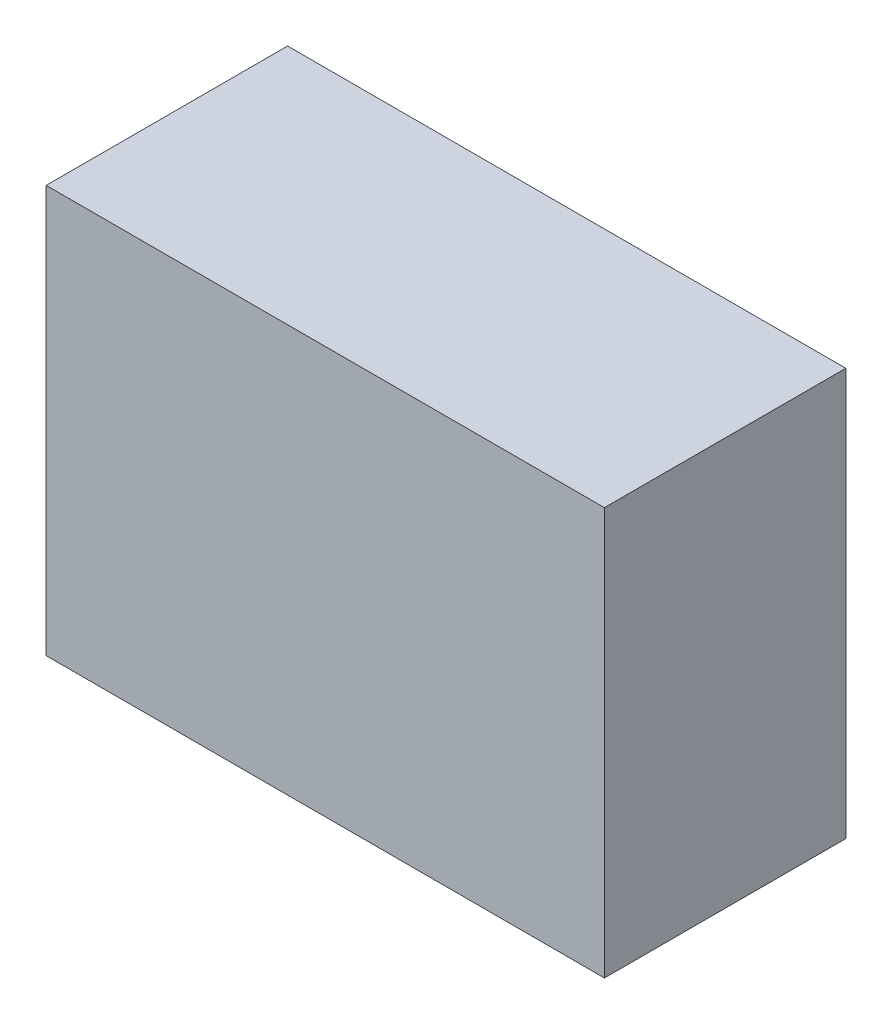
from build123d import *

# Parameters (mm, degrees)
SKETCH1_W     = 37
SKETCH1_H     = 27
PROFILE_DEPTH = 16


with BuildPart() as part:
    # Sketch1 → Profile (new body)
    with BuildSketch(Plane.XY):
        with Locations((18.5, 13.5)):
            Rectangle(SKETCH1_W, SKETCH1_H)
    extrude(amount=PROFILE_DEPTH)


solid = part.part
